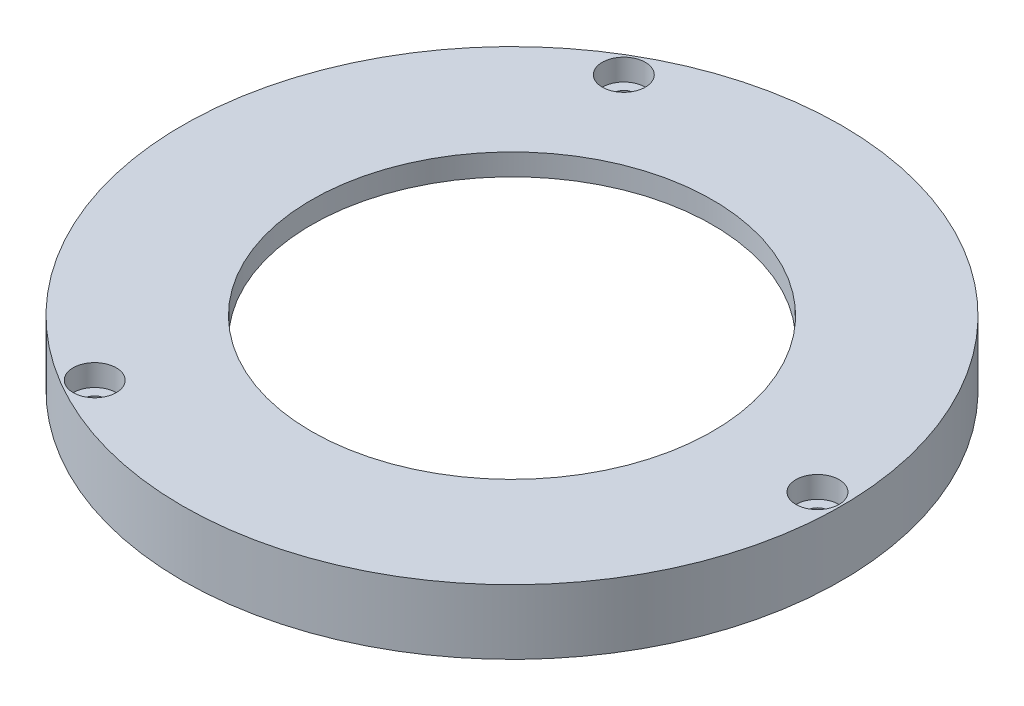
from build123d import *

# Parameters (mm, degrees)
SKETCH1_R           = 45.85
SKETCH1_R_2         = 1.5635
SKETCH1_R_3         = 39.3
BOSS_EXTRUDE1_DEPTH = 6
BOSS_EXTRUDE2_START = 3
SKETCH1_4_R         = 45.85
SKETCH1_4_R_2       = 1.5635
SKETCH1_4_R_3       = 27.9
BOSS_EXTRUDE2_DEPTH = 3
SKETCH2_R           = 3
CUT_EXTRUDE1_DEPTH  = 3


with BuildPart() as part:
    # Sketch1 → Boss-Extrude1 (new body)
    with BuildSketch(Plane(origin=(0, 0, 0), x_dir=(1, 0, 0), z_dir=(0, 1, 0))):
        Circle(SKETCH1_R)
        with Locations((-21.25, -36.806079661)):
            Circle(SKETCH1_R_2, mode=Mode.SUBTRACT)
        with Locations((-21.25, 36.806079661)):
            Circle(SKETCH1_R_2, mode=Mode.SUBTRACT)
        Circle(SKETCH1_R_3, mode=Mode.SUBTRACT)
        with Locations((42.5, 0)):
            Circle(SKETCH1_R_2, mode=Mode.SUBTRACT)
    extrude(amount=-BOSS_EXTRUDE1_DEPTH)

    # Sketch1<4> → Boss-Extrude2 (add)
    with BuildSketch(Plane(origin=(0, 0, 0), x_dir=(1, 0, 0), z_dir=(0, 1, 0)).offset(BOSS_EXTRUDE2_START)):
        Circle(SKETCH1_4_R)
        with Locations((-21.25, -36.806079661)):
            Circle(SKETCH1_4_R_2, mode=Mode.SUBTRACT)
        with Locations((-21.25, 36.806079661)):
            Circle(SKETCH1_4_R_2, mode=Mode.SUBTRACT)
        with Locations((42.5, 0)):
            Circle(SKETCH1_4_R_2, mode=Mode.SUBTRACT)
        Circle(SKETCH1_4_R_3, mode=Mode.SUBTRACT)
    extrude(amount=-BOSS_EXTRUDE2_DEPTH)

    # Sketch2 → Cut-Extrude1 (cut)
    with BuildSketch(Plane(origin=(0, 3, 0), x_dir=(1, 0, 0), z_dir=(0, 1, 0))):
        with Locations((42.5, 0)):
            Circle(SKETCH2_R)
        with Locations((-21.25, -36.806079661)):
            Circle(SKETCH2_R)
        with Locations((-21.25, 36.806079661)):
            Circle(SKETCH2_R)
    extrude(amount=-CUT_EXTRUDE1_DEPTH, mode=Mode.SUBTRACT)


solid = part.part
